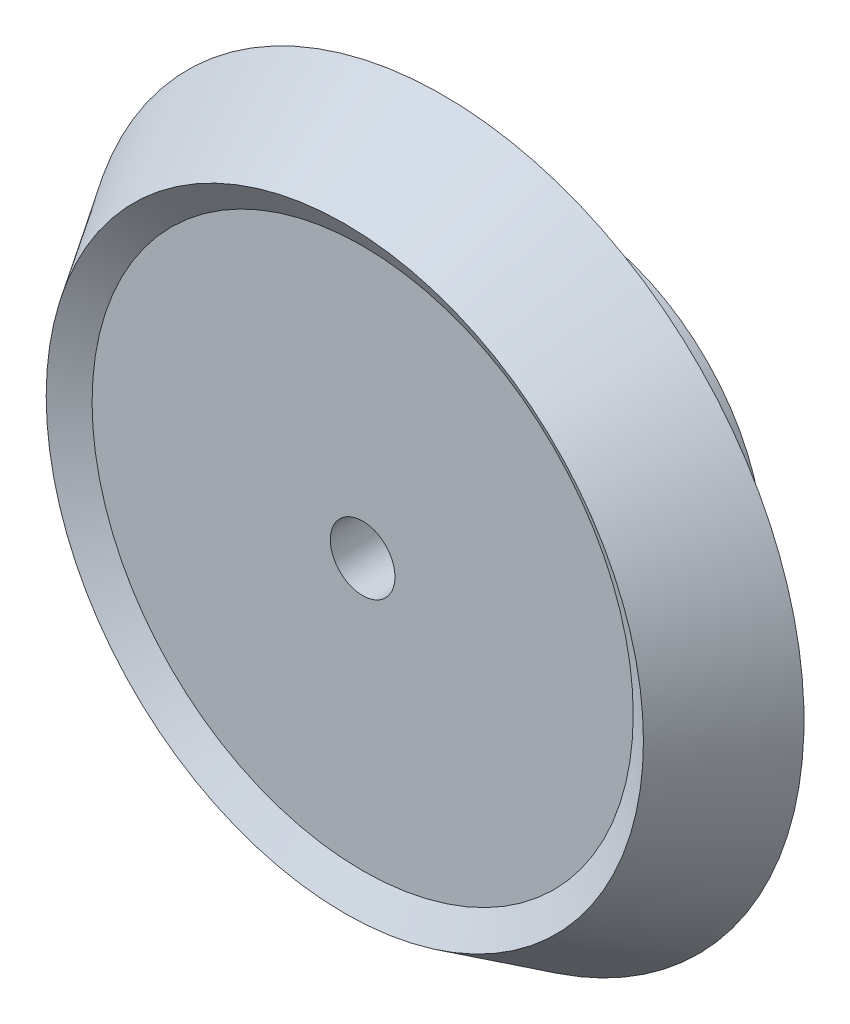
from build123d import *


with BuildPart() as part:
    # Çizim1 → Döndür1 (revolve)
    with BuildSketch(Plane(origin=(0, 0, 0), x_dir=(0, 0, -1), z_dir=(1, 0, 0)), mode=Mode.PRIVATE) as d_nd_r1_sk:
        with BuildLine():
            Line((0, 7.25), (0, 60.706950554))
            Line((0, 60.706950554), (-4, 67))
            Line((-4, 67), (18.02567306, 81))
            Line((18.02567306, 81), (26, 68.454291568))
            Line((26, 68.454291568), (26, 54))
            ThreePointArc((26, 54), (28.928932188, 46.928932188), (36, 44))
            Line((36, 44), (46, 44))
            Line((46, 44), (46, 7.25))
            Line((46, 7.25), (0, 7.25))
        make_face()
    revolve(d_nd_r1_sk.sketch.rotate(Axis((0, 0, -100.24473813), (0, 0, 1)), 90), axis=Axis((0, 0, -100.24473813), (0, 0, 1)))


solid = part.part
